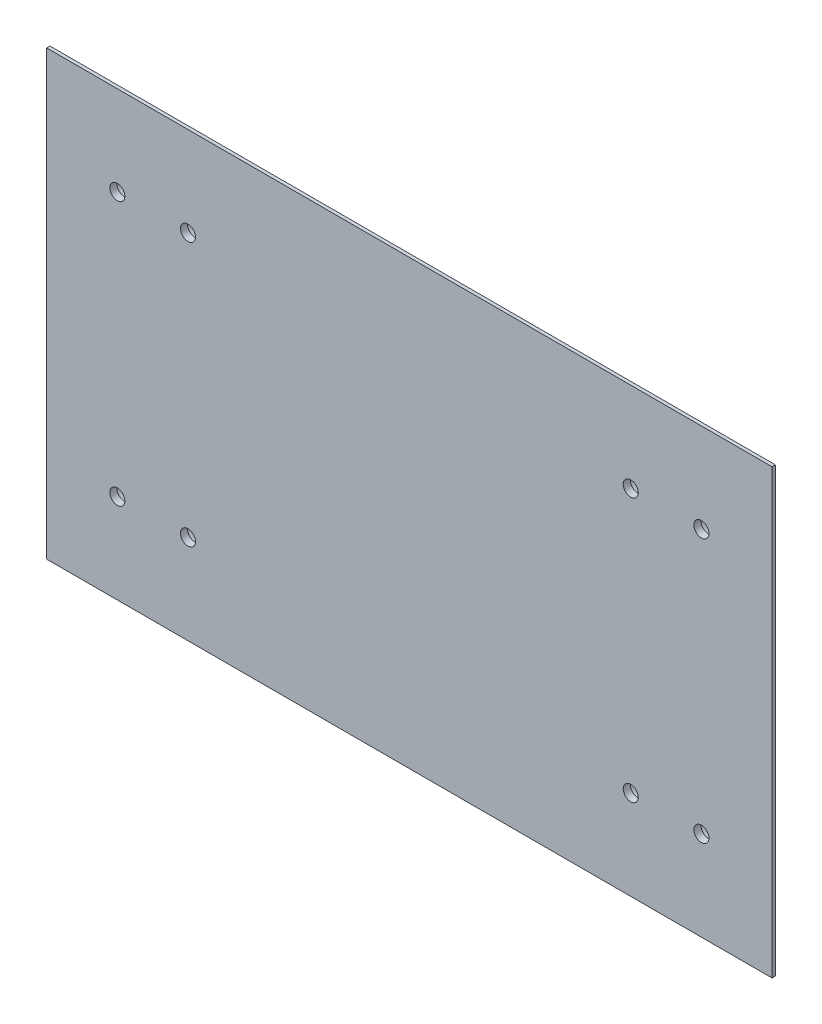
from build123d import *

# Parameters (mm, degrees)
SKETCH1_W           = 140
SKETCH1_H           = 80
BOSS_EXTRUDE1_DEPTH = 6
SKETCH2_R           = 1.6
CUT_EXTRUDE1_DEPTH  = 81.845531726
SKETCH3_R           = 3.5
CUT_EXTRUDE2_DEPTH  = 4.5
SKETCH4_W           = 154
SKETCH4_H           = 94
SKETCH4_W_2         = 140
SKETCH4_H_2         = 80
BOSS_EXTRUDE2_DEPTH = 0.7


with BuildPart() as part:
    # Sketch1 → Boss-Extrude1 (new body)
    with BuildSketch(Plane.XY):
        Rectangle(SKETCH1_W, SKETCH1_H)
    extrude(amount=BOSS_EXTRUDE1_DEPTH)

    # Sketch2 → Cut-Extrude1 (cut, through all)
    with BuildSketch(Plane.XY.offset(6)):
        with Locations((-62, 28)):
            Circle(SKETCH2_R)
        with Locations((-47, 28)):
            Circle(SKETCH2_R)
        with Locations((47, 28)):
            Circle(SKETCH2_R)
        with Locations((62, 28)):
            Circle(SKETCH2_R)
        with Locations((47, -28)):
            Circle(SKETCH2_R)
        with Locations((62, -28)):
            Circle(SKETCH2_R)
        with Locations(Location((-62, -28, 0), (0, 0, 180))):
            Circle(SKETCH2_R)
        with Locations(Location((-47, -28, 0), (0, 0, 180))):
            Circle(SKETCH2_R)
    extrude(amount=-CUT_EXTRUDE1_DEPTH, mode=Mode.SUBTRACT)

    # Sketch3 → Cut-Extrude2 (cut)
    with BuildSketch(Plane(origin=(0, 0, 0), x_dir=(-1, 0, 0), z_dir=(0, 0, -1))):
        with Locations((62, 28)):
            Circle(SKETCH3_R)
        with Locations((47, 28)):
            Circle(SKETCH3_R)
        with Locations((-47, 28)):
            Circle(SKETCH3_R)
        with Locations((-62, 28)):
            Circle(SKETCH3_R)
        with Locations((-47, -28)):
            Circle(SKETCH3_R)
        with Locations((-62, -28)):
            Circle(SKETCH3_R)
        with Locations((62, -28)):
            Circle(SKETCH3_R)
        with Locations((47, -28)):
            Circle(SKETCH3_R)
    extrude(amount=-CUT_EXTRUDE2_DEPTH, mode=Mode.SUBTRACT)

    # Sketch4 → Boss-Extrude2 (add)
    with BuildSketch(Plane.XY.offset(6)):
        Rectangle(SKETCH4_W, SKETCH4_H)
        Rectangle(SKETCH4_W_2, SKETCH4_H_2, mode=Mode.SUBTRACT)
    extrude(amount=-BOSS_EXTRUDE2_DEPTH)


solid = part.part
